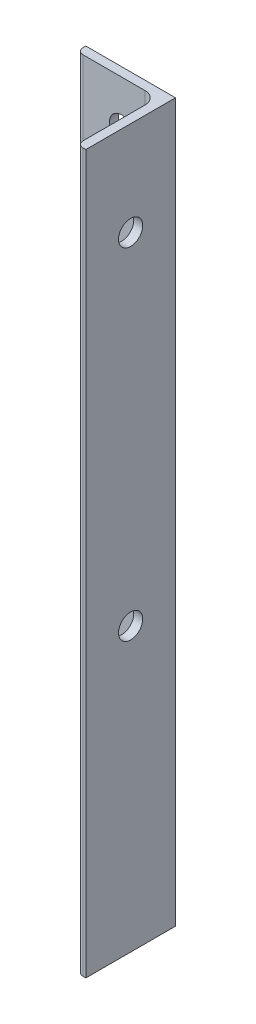
from build123d import *

# Parameters (mm, degrees)
BOSS_EXTRUDE1_DEPTH = 200
CUT_EXTRUDE1_REACH  = 214.132
SKETCH2_R           = 6.75
CUT_EXTRUDE2_REACH  = 214.132
SKETCH3_R           = 6.75


with BuildPart() as part:
    # Sketch1 → Boss-Extrude1 (new, symmetric)
    with BuildSketch(Plane(origin=(0, 0, 0), x_dir=(1, 0, 0), z_dir=(0, 1, 0))):
        with BuildLine():
            Line((0, 0), (-50, 0))
            Line((-50, 0), (-50, -1.5))
            ThreePointArc((-50, -1.5), (-48.974873734, -3.974873734), (-46.5, -5))
            Line((-46.5, -5), (-12, -5))
            ThreePointArc((-12, -5), (-7.050252532, -7.050252532), (-5, -12))
            Line((-5, -12), (-5, -46.5))
            ThreePointArc((-5, -46.5), (-3.974873734, -48.974873734), (-1.5, -50))
            Line((-1.5, -50), (0, -50))
            Line((0, -50), (0, 0))
        make_face()
    extrude(amount=BOSS_EXTRUDE1_DEPTH, both=True)

    # Sketch2 → Cut-Extrude1 (cut, up to next)
    with BuildSketch(Plane(origin=(0, 0, 0), x_dir=(-1, 0, 0), z_dir=(0, 0, -1)), mode=Mode.PRIVATE) as cut_extrude1_sk1:
        with Locations((25, 175)):
            Circle(SKETCH2_R)
    cut_extrude1_tool1 = extrude(cut_extrude1_sk1.sketch, amount=-CUT_EXTRUDE1_REACH, mode=Mode.PRIVATE) & part.part
    # Sketch2 → Cut-Extrude1 (cut, up to next)
    with BuildSketch(Plane(origin=(0, 0, 0), x_dir=(-1, 0, 0), z_dir=(0, 0, -1)), mode=Mode.PRIVATE) as cut_extrude1_sk2:
        with Locations((25, 0)):
            Circle(SKETCH2_R)
    cut_extrude1_tool2 = extrude(cut_extrude1_sk2.sketch, amount=-CUT_EXTRUDE1_REACH, mode=Mode.PRIVATE) & part.part
    add(cut_extrude1_tool1.solids().sort_by_distance((-25, 175, 0))[0], mode=Mode.SUBTRACT)
    add(cut_extrude1_tool2.solids().sort_by_distance((-25, 0, 0))[0], mode=Mode.SUBTRACT)

    # Sketch3 → Cut-Extrude2 (cut, up to next)
    with BuildSketch(Plane(origin=(0, 0, 0), x_dir=(0, 0, -1), z_dir=(1, 0, 0)), mode=Mode.PRIVATE) as cut_extrude2_sk1:
        with Locations((-25, 147.5)):
            Circle(SKETCH3_R)
    cut_extrude2_tool1 = extrude(cut_extrude2_sk1.sketch, amount=-CUT_EXTRUDE2_REACH, mode=Mode.PRIVATE) & part.part
    # Sketch3 → Cut-Extrude2 (cut, up to next)
    with BuildSketch(Plane(origin=(0, 0, 0), x_dir=(0, 0, -1), z_dir=(1, 0, 0)), mode=Mode.PRIVATE) as cut_extrude2_sk2:
        with Locations((-25, -42.5)):
            Circle(SKETCH3_R)
    cut_extrude2_tool2 = extrude(cut_extrude2_sk2.sketch, amount=-CUT_EXTRUDE2_REACH, mode=Mode.PRIVATE) & part.part
    add(cut_extrude2_tool1.solids().sort_by_distance((0, 147.5, 25))[0], mode=Mode.SUBTRACT)
    add(cut_extrude2_tool2.solids().sort_by_distance((0, -42.5, 25))[0], mode=Mode.SUBTRACT)


solid = part.part
